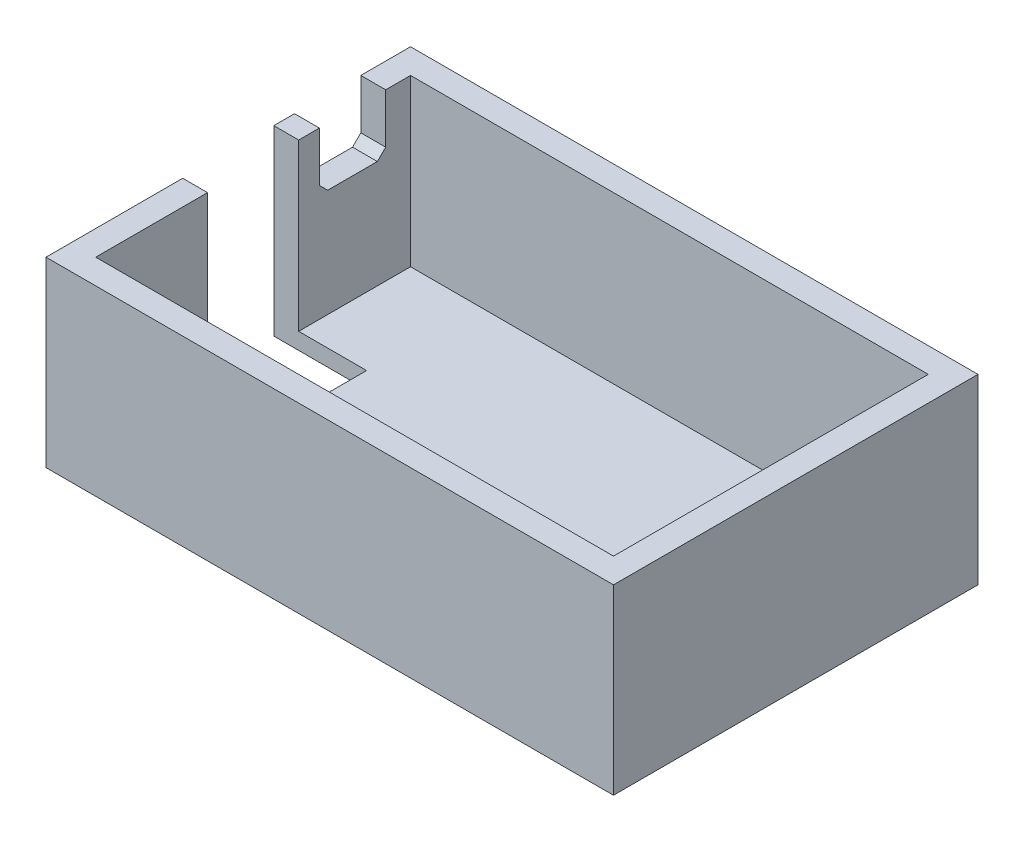
from build123d import *

# Parameters (mm, degrees)
BOSS_EXTRUDE1_DEPTH = 20
SKETCH2_W           = 68.5
SKETCH2_H           = 44
BOSS_EXTRUDE2_DEPTH = 2
SKETCH3_W           = 11
SKETCH3_H           = 2
CUT_EXTRUDE1_DEPTH  = 11.2
SKETCH4_W           = 8
SKETCH4_H           = 7
CUT_EXTRUDE2_DEPTH  = 10
CHAMFER2_SIZE       = 1


with BuildPart() as part:
    # Sketch1 → Boss-Extrude1 (new body)
    with BuildSketch(Plane(origin=(0, 0, 0), x_dir=(1, 0, 0), z_dir=(0, 1, 0))):
        Polygon((-33.284090909, -14.318181818), (-33.284090909, -27.818181818), (29.215909091, -27.818181818), (29.215909091, 10.181818182), (-33.284090909, 10.181818182), (-33.284090909, -3.318181818), (-36.284090909, -3.318181818), (-36.284090909, 13.181818182), (32.215909091, 13.181818182), (32.215909091, -30.818181818), (-36.284090909, -30.818181818), (-36.284090909, -14.318181818), align=None)
    extrude(amount=BOSS_EXTRUDE1_DEPTH)

    # Sketch2 → Boss-Extrude2 (add)
    with BuildSketch(Plane.XZ):
        with Locations((-2.034090909, 8.818181818)):
            Rectangle(SKETCH2_W, SKETCH2_H)
    extrude(amount=BOSS_EXTRUDE2_DEPTH)

    # Sketch3 → Cut-Extrude1 (cut)
    with BuildSketch(Plane.ZY.offset(36.284090909)):
        with Locations((8.818181818, -1)):
            Rectangle(SKETCH3_W, SKETCH3_H)
    extrude(amount=-CUT_EXTRUDE1_DEPTH, mode=Mode.SUBTRACT)

    # Sketch4 → Cut-Extrude2 (cut)
    with BuildSketch(Plane(origin=(-33.284090909, 0, 0), x_dir=(0, 0, -1), z_dir=(1, 0, 0))):
        with Locations((3.181818182, 16.5)):
            Rectangle(SKETCH4_W, SKETCH4_H)
    extrude(amount=-CUT_EXTRUDE2_DEPTH, mode=Mode.SUBTRACT)

    # Chamfer2
    chamfer2_edges = [part.edges().sort_by_distance(p)[0] for p in [
        (-34.784090909, 13, -7.181818182),
        (-34.784090909, 13, 0.818181818),
    ]]
    chamfer(chamfer2_edges, length=CHAMFER2_SIZE)


solid = part.part
